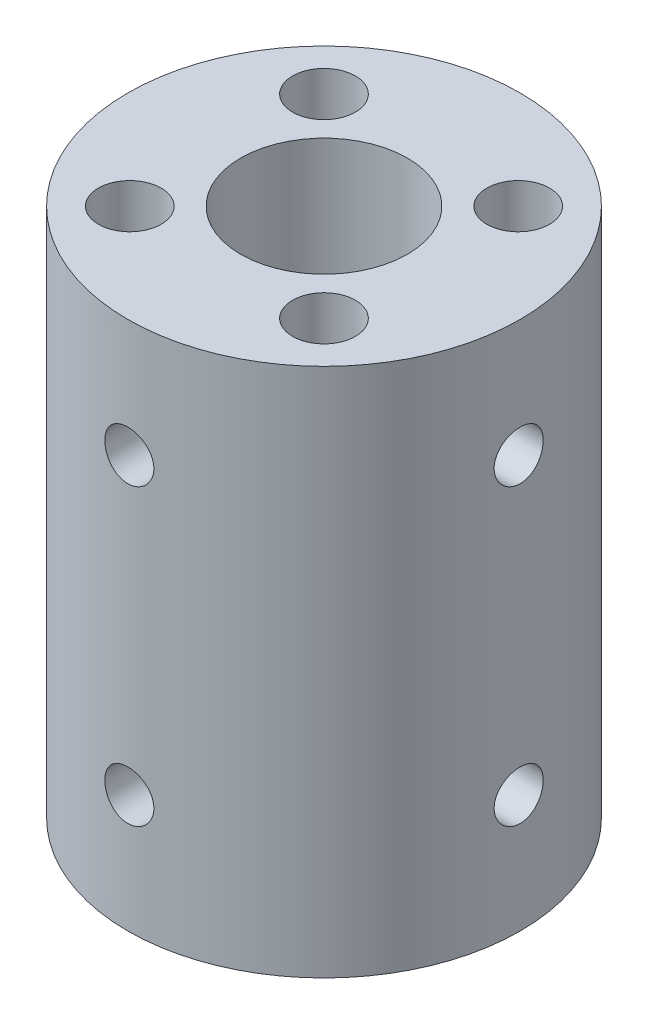
from build123d import *

# Parameters (mm, degrees)
SKETCH_1_R               = 10
SKETCH_1_R_2             = 4.25
SKETCH_1_R_3             = 1.6
EXTRUDE_1_DEPTH          = 13.5
SKETCH_2_R               = 1.25
CUT_EXTRUDE_1_DEPTH      = 20.551214796
PATTERN_CIRCULAR_1_COUNT = 4


with BuildPart() as part:
    # 草图1 → 凸台-拉伸1 (new, symmetric)
    with BuildSketch(Plane(origin=(0, 0, 0), x_dir=(1, 0, 0), z_dir=(0, 1, 0))):
        with Locations(Location((0, 0, 0), (0, 0, 270))):
            Circle(SKETCH_1_R)
        with Locations(Location((0, 0, 0), (0, 0, 270))):
            Circle(SKETCH_1_R_2, mode=Mode.SUBTRACT)
        with Locations(Location((-4.949747468, 4.949747468, 0), (0, 0, 270))):
            Circle(SKETCH_1_R_3, mode=Mode.SUBTRACT)
        with Locations(Location((-4.949747468, -4.949747468, 0), (0, 0, 270))):
            Circle(SKETCH_1_R_3, mode=Mode.SUBTRACT)
        with Locations(Location((4.949747468, -4.949747468, 0), (0, 0, 270))):
            Circle(SKETCH_1_R_3, mode=Mode.SUBTRACT)
        with Locations(Location((4.949747468, 4.949747468, 0), (0, 0, 270))):
            Circle(SKETCH_1_R_3, mode=Mode.SUBTRACT)
    extrude(amount=EXTRUDE_1_DEPTH, both=True)

    # 草图2 → 切除-拉伸1 (cut, through all)
    with BuildSketch(Plane.XY):
        with Locations(Location((0, 7.5, 0), (0, 0, 90))):
            Circle(SKETCH_2_R)
        with Locations(Location((0, -7.5, 0), (0, 0, 90))):
            Circle(SKETCH_2_R)
    cut_extrude_1 = extrude(amount=-CUT_EXTRUDE_1_DEPTH, mode=Mode.SUBTRACT)

    # 阵列(圆周)1: 切除-拉伸1 ×4 about axis
    pattern_circular_1_axis = Axis((0, 13.5, 0), (0, 1, 0))
    for i in range(1, PATTERN_CIRCULAR_1_COUNT):
        add(cut_extrude_1.rotate(pattern_circular_1_axis, i * 360 / PATTERN_CIRCULAR_1_COUNT), mode=Mode.SUBTRACT)


solid = part.part
